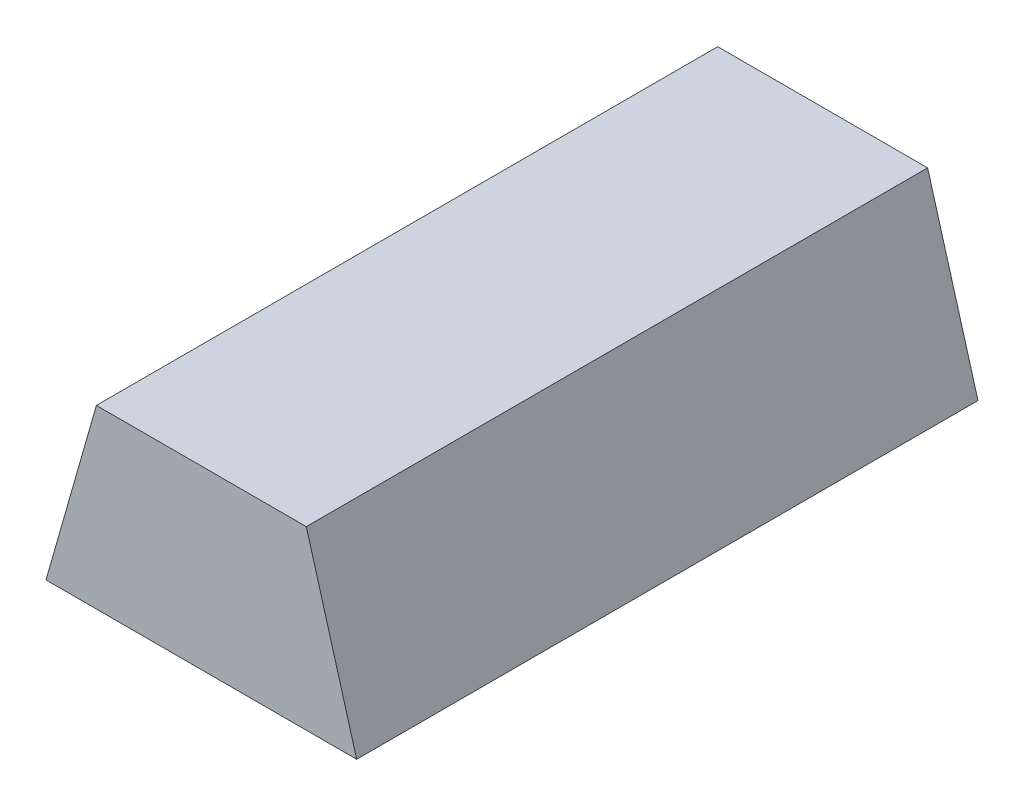
from build123d import *

# Parameters (mm, degrees)
BOSS_EXTRUDE1_DEPTH = 74


with BuildPart() as part:
    # Sketch1 → Boss-Extrude1 (new body)
    with BuildSketch(Plane.XY):
        Polygon((-12.5, 10.5), (12.5, 10.5), (18.5, -10.5), (-18.5, -10.5), align=None)
    extrude(amount=BOSS_EXTRUDE1_DEPTH)


solid = part.part
